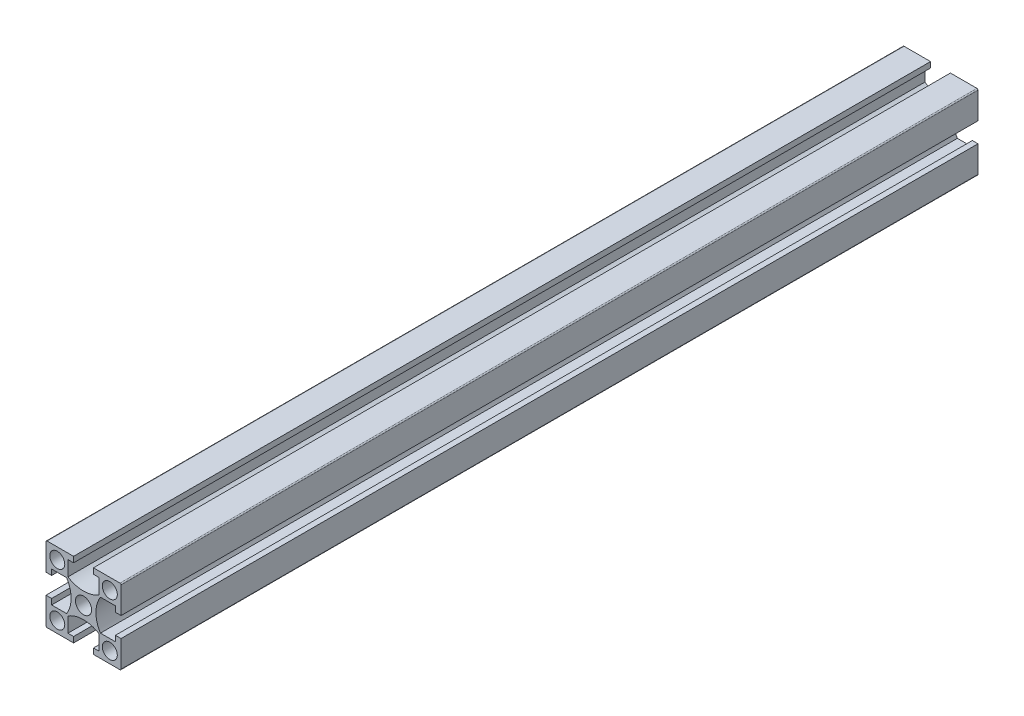
from build123d import *

# Parameters (mm, degrees)
SKETCH_1_W               = 20
SKETCH_1_H               = 20
SKETCH_1_R               = 2
SKETCH_1_R_2             = 2.15
EXTRUDE_1_DEPTH          = 345
CUT_EXTRUDE_1_REACH      = 347.29
PATTERN_CIRCULAR_1_COUNT = 4
FILLET_1_R               = 0.3
CUT_EXTRUDE_2_DEPTH      = 346.289733412
CUT_EXTRUDE_2_DEPTH_BACK = 346.289733412
SKETCH_2_R               = 2.5
SKETCH_4_R               = 2.15
CUT_EXTRUDE_3_DEPTH      = 346.723878361
SKETCH_6_R               = 2.15
SKETCH_6_R_2             = 1.97965
CUT_EXTRUDE_4_DEPTH      = 346.723878361
SKETCH_7_W               = 20
SKETCH_7_H               = 116.62
CUT_EXTRUDE_5_DEPTH      = 346.723878361


with BuildPart() as part:
    # 스케치1 → 보스-돌출1 (new body)
    with BuildSketch(Plane.XY):
        Rectangle(SKETCH_1_W, SKETCH_1_H)
        with Locations((-7, -7)):
            Circle(SKETCH_1_R, mode=Mode.SUBTRACT)
        with Locations((7, -7)):
            Circle(SKETCH_1_R, mode=Mode.SUBTRACT)
        with Locations((-7, 7)):
            Circle(SKETCH_1_R, mode=Mode.SUBTRACT)
        Circle(SKETCH_1_R_2, mode=Mode.SUBTRACT)
        with Locations((7, 7)):
            Circle(SKETCH_1_R, mode=Mode.SUBTRACT)
    extrude(amount=EXTRUDE_1_DEPTH)

    # 스케치1<3> → 컷-돌출1 (cut, up to next)
    with BuildSketch(Plane.XY, mode=Mode.PRIVATE) as cut_extrude_1_sk1:
        with BuildLine():
            Line((-8.5, 2.65), (-10, 2.65))
            Line((-10, 2.65), (-10, -2.65))
            Line((-10, -2.65), (-8.5, -2.65))
            Line((-8.5, -2.65), (-8.5, -4.15))
            Line((-8.5, -4.15), (-4.503166667, -4.15))
            ThreePointArc((-4.503166667, -4.15), (-3.3, 0), (-4.503166667, 4.15))
            Line((-4.503166667, 4.15), (-8.5, 4.15))
            Line((-8.5, 4.15), (-8.5, 2.65))
        make_face()
    cut_extrude_1_tool1 = extrude(cut_extrude_1_sk1.sketch, amount=CUT_EXTRUDE_1_REACH, mode=Mode.PRIVATE) & part.part
    cut_extrude_1 = cut_extrude_1_tool1.solids().sort_by_distance((-6.606913, 0, 0))[0]
    add(cut_extrude_1, mode=Mode.SUBTRACT)

    # 원형 패턴1: 컷-돌출1 ×4 about axis
    pattern_circular_1_axis = Axis((0, 0, 345), (0, 0, -1))
    for i in range(1, PATTERN_CIRCULAR_1_COUNT):
        add(cut_extrude_1.rotate(pattern_circular_1_axis, i * 360 / PATTERN_CIRCULAR_1_COUNT), mode=Mode.SUBTRACT)

    # 필렛1
    fillet_1_edges = [part.edges().sort_by_distance(p)[0] for p in [
        (10, -10, 172.5),
        (-10, -10, 172.5),
        (-10, 10, 172.5),
        (10, 10, 172.5),
    ]]
    fillet(fillet_1_edges, radius=FILLET_1_R)

    # 스케치2 → 컷-돌출2 (cut, two sides: drawn at the far end of the back side and taken through both)
    with BuildSketch(Plane(origin=(0, 0, 0), x_dir=(0, 0, -1), z_dir=(1, 0, 0)).offset(-CUT_EXTRUDE_2_DEPTH_BACK)):
        with Locations((-25, 0)):
            Circle(SKETCH_2_R)
    extrude(amount=CUT_EXTRUDE_2_DEPTH + CUT_EXTRUDE_2_DEPTH_BACK, mode=Mode.SUBTRACT)

    # 스케치4 → 컷-돌출3 (cut, through all)
    with BuildSketch(Plane(origin=(0, 10, 0), x_dir=(1, 0, 0), z_dir=(0, 1, 0))):
        with Locations((0, -303)):
            Circle(SKETCH_4_R)
    extrude(amount=-CUT_EXTRUDE_3_DEPTH, mode=Mode.SUBTRACT)

    # 스케치6 → 컷-돌출4 (cut, through all)
    with BuildSketch(Plane(origin=(0, 10, 0), x_dir=(1, 0, 0), z_dir=(0, 1, 0))):
        with Locations((0, -236.9)):
            Circle(SKETCH_6_R)
        with Locations((0, -184.9)):
            Circle(SKETCH_6_R)
        with Locations((0, -10.15)):
            Circle(SKETCH_6_R_2)
        with Locations((0, -62.15)):
            Circle(SKETCH_6_R)
    extrude(amount=-CUT_EXTRUDE_4_DEPTH, mode=Mode.SUBTRACT)

    # 스케치7 → 컷-돌출5 (cut, through all)
    with BuildSketch(Plane(origin=(0, 10, 0), x_dir=(1, 0, 0), z_dir=(0, 1, 0))):
        with Locations((0, -58.31)):
            Rectangle(SKETCH_7_W, SKETCH_7_H)
    extrude(amount=-CUT_EXTRUDE_5_DEPTH, mode=Mode.SUBTRACT)


solid = part.part
